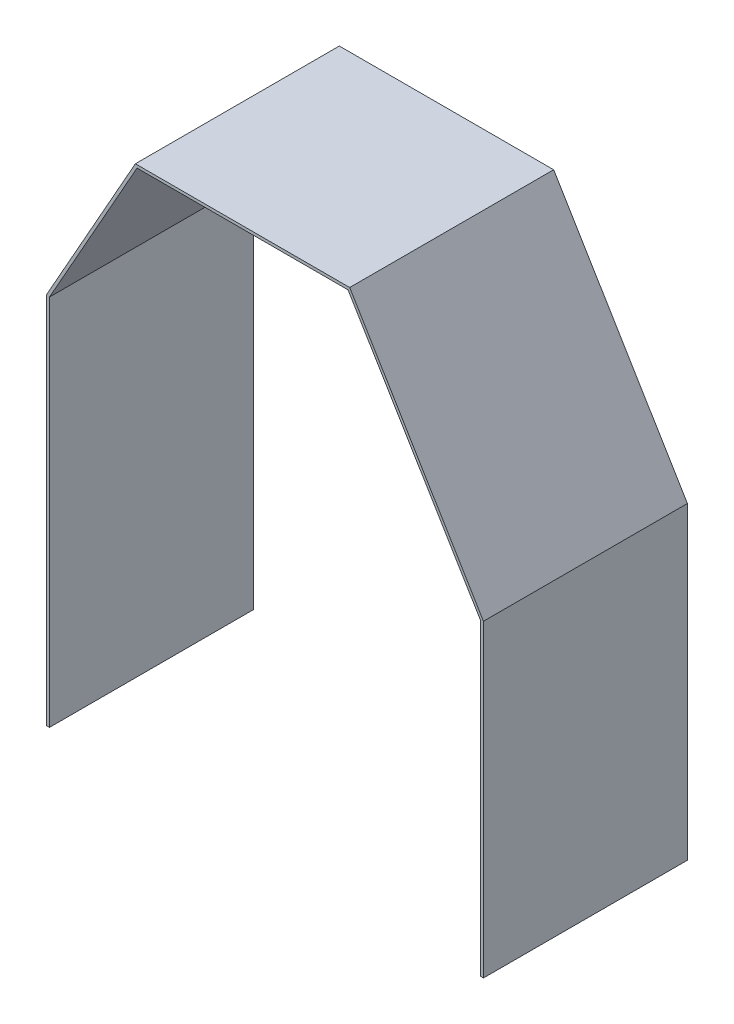
from build123d import *

# Parameters (mm, degrees)
EXTRUDE_1_DEPTH = 142


with BuildPart() as part:
    # Эскиз1 → Вытянуть-Тонкостенный1 (new body)
    with BuildSketch(Plane.XY):
        Polygon((-2.000007305, 3.805e-06), (-2.000007305, 260.000004066), (59.807474711, 369.746927632), (209.01237589, 369.746927632), (302.134985909, 215.086200501), (302.134985909, -3.32e-07), (300.134985909, -3.32e-07), (300.134985909, 214.530564088), (207.882040151, 367.746927632), (60.976474796, 367.746927632), (-7.305e-06, 259.475548469), (-7.305e-06, 3.805e-06), align=None)
    extrude(amount=-EXTRUDE_1_DEPTH)


solid = part.part
